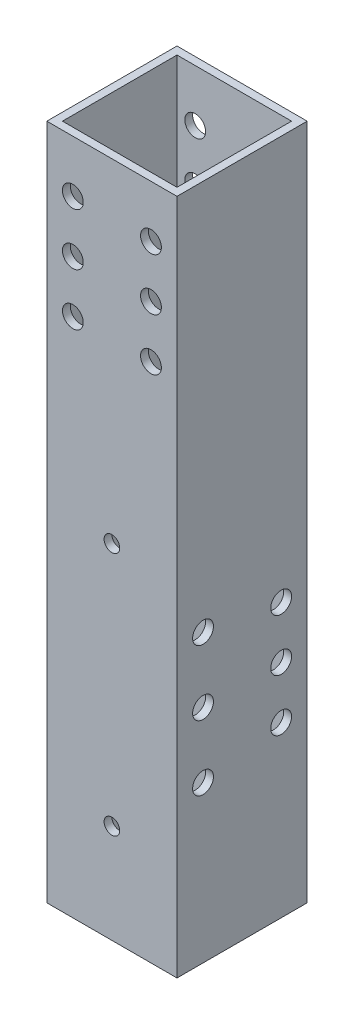
from build123d import *

# Parameters (mm, degrees)
BOSS_EXTRUDE1_DEPTH      = 65
BOSS_EXTRUDE1_DEPTH_BACK = 65
SKETCH3_W                = 25
SKETCH3_H                = 25
SKETCH3_W_2              = 22
SKETCH3_H_2              = 22
SKETCH5_R                = 1.5
CUT_EXTRUDE2_DEPTH       = 25
SKETCH6_R                = 2
CUT_EXTRUDE3_DEPTH       = 25
SKETCH7_R                = 2
CUT_EXTRUDE4_DEPTH       = 25


with BuildPart() as part:
    # Sketch3 → Boss-Extrude1 (new, two sides: drawn at the far end of the back side and taken through both)
    with BuildSketch(Plane(origin=(0, 0, 0), x_dir=(1, 0, 0), z_dir=(0, 1, 0)).offset(-BOSS_EXTRUDE1_DEPTH_BACK)):
        Rectangle(SKETCH3_W, SKETCH3_H)
        Rectangle(SKETCH3_W_2, SKETCH3_H_2, mode=Mode.SUBTRACT)
    extrude(amount=BOSS_EXTRUDE1_DEPTH + BOSS_EXTRUDE1_DEPTH_BACK)

    # Sketch5 → Cut-Extrude2 (cut)
    with BuildSketch(Plane(origin=(0, 0, -12.5), x_dir=(-1, 0, 0), z_dir=(0, 0, -1))):
        with Locations((0, -46)):
            Circle(SKETCH5_R)
        with Locations((0, 1)):
            Circle(SKETCH5_R)
    extrude(amount=-CUT_EXTRUDE2_DEPTH, mode=Mode.SUBTRACT)

    # Sketch6 → Cut-Extrude3 (cut)
    with BuildSketch(Plane(origin=(12.5, 0, 0), x_dir=(0, 0, -1), z_dir=(1, 0, 0))):
        with Locations((7.5, -32.5)):
            Circle(SKETCH6_R)
        with Locations((7.5, -12.5)):
            Circle(SKETCH6_R)
        with Locations((-7.5, -35)):
            Circle(SKETCH6_R)
        with Locations((-7.5, -10)):
            Circle(SKETCH6_R)
        with Locations((7.5, -22.5)):
            Circle(SKETCH6_R)
        with Locations((-7.5, -22.5)):
            Circle(SKETCH6_R)
    extrude(amount=-CUT_EXTRUDE3_DEPTH, mode=Mode.SUBTRACT)

    # Sketch7 → Cut-Extrude4 (cut)
    with BuildSketch(Plane(origin=(0, 0, -12.5), x_dir=(-1, 0, 0), z_dir=(0, 0, -1))):
        with Locations((7.5, 55)):
            Circle(SKETCH7_R)
        with Locations((7.5, 45)):
            Circle(SKETCH7_R)
        with Locations((-7.5, 55)):
            Circle(SKETCH7_R)
        with Locations((-7.5, 45)):
            Circle(SKETCH7_R)
        with Locations((-7.5, 35)):
            Circle(SKETCH7_R)
        with Locations((7.5, 35)):
            Circle(SKETCH7_R)
    extrude(amount=-CUT_EXTRUDE4_DEPTH, mode=Mode.SUBTRACT)


solid = part.part
